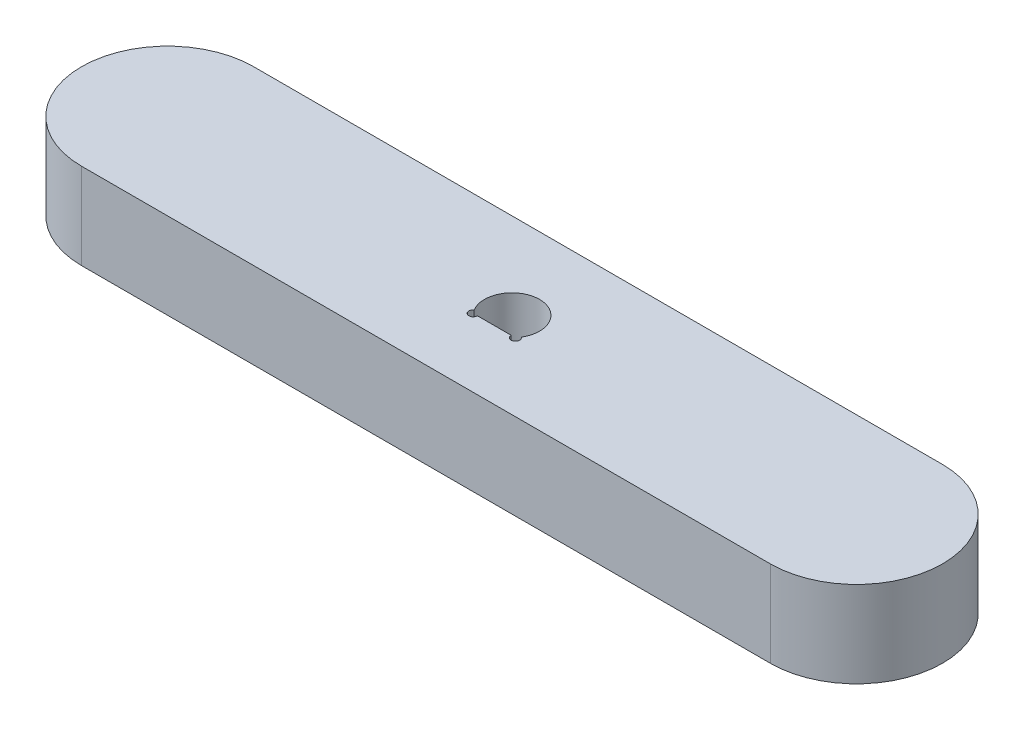
from build123d import *
from build123d.topology import SkipClean

# Parameters (mm, degrees)
BOSS_EXTRUDE1_DEPTH     = 5
CUT_EXTRUDE1_DEPTH      = 46.552167896
CUT_EXTRUDE1_DEPTH_BACK = 46.552167896
SKETCH2_R               = 0.25


with BuildPart() as part:
    # Sketch1 → Boss-Extrude1 (new body)
    with BuildSketch(Plane(origin=(0, 0, 0), x_dir=(1, 0, 0), z_dir=(0, 1, 0))):
        with BuildLine():
            Line((-40, 5), (0, 5))
            ThreePointArc((0, 5), (5, 0), (0, -5))
            Line((0, -5), (-40, -5))
            ThreePointArc((-40, -5), (-45, 0), (-40, 5))
        make_face()
    extrude(amount=BOSS_EXTRUDE1_DEPTH)

    # Sketch2 → Cut-Extrude1 (cut, two sides: drawn at the far end of the back side and taken through both)
    with SkipClean():  # the faces are left unmerged after this step: merging them gives an invalid solid
        with BuildSketch(Plane(origin=(0, 5, 0), x_dir=(1, 0, 0), z_dir=(0, 1, 0)).offset(-CUT_EXTRUDE1_DEPTH_BACK)):
            with Locations((-18.775, -1.029259443)):
                Circle(SKETCH2_R)
            with BuildLine():
                Line((-18.775, -1.029259443), (-21.225, -1.029259443))
                ThreePointArc((-21.225, -1.029259443), (-20, 1.6), (-18.775, -1.029259443))
            make_face()
            with BuildLine():
                ThreePointArc((-18.775, -1.029259443), (-20, 1.6), (-21.225, -1.029259443))
                Line((-21.225, -1.029259443), (-18.775, -1.029259443))
            make_face()
            with BuildLine():
                ThreePointArc((-18.629623366, -0.82587401), (-18.606910194, 0.786956665), (-20, 1.6))
                Line((-20, 1.6), (-20, -1.029259443))
                Line((-20, -1.029259443), (-19.025, -1.029259443))
                ThreePointArc((-19.025, -1.029259443), (-18.889358737, -0.806948671), (-18.629623366, -0.82587401))
            make_face()
            with BuildLine():
                Line((-20, -1.029259443), (-20, 1.6))
                ThreePointArc((-20, 1.6), (-21.393089806, 0.786956665), (-21.370376634, -0.82587401))
                ThreePointArc((-21.370376634, -0.82587401), (-21.110641263, -0.806948671), (-20.975, -1.029259443))
                Line((-20.975, -1.029259443), (-20, -1.029259443))
            make_face()
            with Locations((-21.225, -1.029259443)):
                Circle(SKETCH2_R)
        extrude(amount=CUT_EXTRUDE1_DEPTH + CUT_EXTRUDE1_DEPTH_BACK, mode=Mode.SUBTRACT)


solid = part.part
